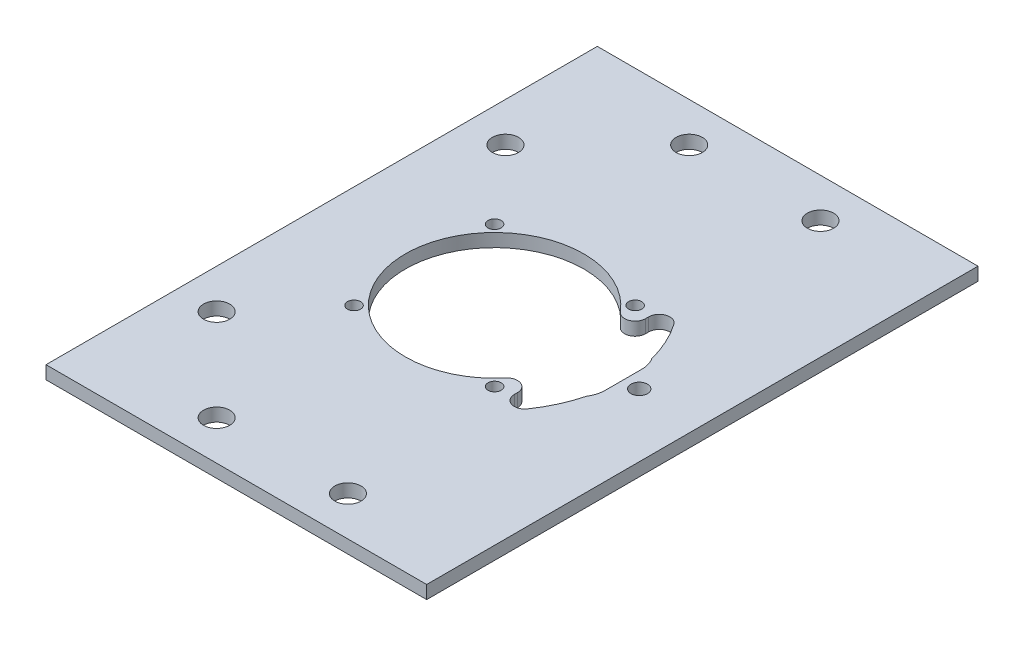
from build123d import *

# Parameters (mm, degrees)
SKETCH1_W           = 190.5
SKETCH1_H           = 133.35
BOSS_EXTRUDE1_DEPTH = 3.175
SKETCH3_R           = 21.59
CUT_EXTRUDE2_DEPTH  = 117.310785183
SKETCH4_R           = 1.5875
CUT_EXTRUDE3_DEPTH  = 3.175
SKETCH9_R           = 2
CUT_EXTRUDE5_DEPTH  = 10
SKETCH12_W          = 98.425
SKETCH12_H          = 133.35
CUT_EXTRUDE6_DEPTH  = 117.310785183
SKETCH13_R          = 3.175
CUT_EXTRUDE7_DEPTH  = 117.310785183
CUT_EXTRUDE8_DEPTH  = 117.310785183
BOSS_EXTRUDE2_DEPTH = 3.175
FILLET1_R           = 2.54
CUT_EXTRUDE9_DEPTH  = 117.310785325
FILLET2_R           = 2.54


with BuildPart() as part:
    # Sketch1 → Boss-Extrude1 (new body)
    with BuildSketch(Plane(origin=(0, 0, 0), x_dir=(1, 0, 0), z_dir=(0, 1, 0))):
        Rectangle(SKETCH1_W, SKETCH1_H)
    extrude(amount=BOSS_EXTRUDE1_DEPTH)

    # Sketch3 → Cut-Extrude2 (cut, through all)
    with BuildSketch(Plane(origin=(0, 3.175, 0), x_dir=(1, 0, 0), z_dir=(0, 1, 0))):
        with Locations(Location((-53.425, 0, 0), (0, 0, 270))):
            Circle(SKETCH3_R)
    extrude(amount=-CUT_EXTRUDE2_DEPTH, mode=Mode.SUBTRACT)

    # Sketch4 → Cut-Extrude3 (cut)
    with BuildSketch(Plane(origin=(0, 3.175, 0), x_dir=(1, 0, 0), z_dir=(0, 1, 0))):
        with Locations(Location((-70.425, 17, 0), (0, 0, 270))):
            Circle(SKETCH4_R)
        with Locations(Location((-36.425, 17, 0), (0, 0, 270))):
            Circle(SKETCH4_R)
        with Locations(Location((-70.425, -17, 0), (0, 0, 270))):
            Circle(SKETCH4_R)
        with Locations(Location((-36.425, -17, 0), (0, 0, 270))):
            Circle(SKETCH4_R)
    extrude(amount=-CUT_EXTRUDE3_DEPTH, mode=Mode.SUBTRACT)

    # Sketch9 → Cut-Extrude5 (cut)
    with BuildSketch(Plane(origin=(0, 3.175, 0), x_dir=(1, 0, 0), z_dir=(0, 1, 0))):
        with Locations(Location((-18.4365, 0, 0), (0, 0, 270))):
            Circle(SKETCH9_R)
    extrude(amount=-CUT_EXTRUDE5_DEPTH, mode=Mode.SUBTRACT)

    # Sketch12 → Cut-Extrude6 (cut, through all)
    with BuildSketch(Plane(origin=(0, 3.175, 0), x_dir=(1, 0, 0), z_dir=(0, 1, 0))):
        with Locations((46.0375, 0)):
            Rectangle(SKETCH12_W, SKETCH12_H)
    extrude(amount=-CUT_EXTRUDE6_DEPTH, mode=Mode.SUBTRACT)

    # Sketch13 → Cut-Extrude7 (cut, through all)
    with BuildSketch(Plane(origin=(0, 3.175, 0), x_dir=(1, 0, 0), z_dir=(0, 1, 0))):
        with Locations(Location((-63.5, -57.15, 0), (0, 0, 270))):
            Circle(SKETCH13_R)
        with Locations(Location((-31.75, -57.15, 0), (0, 0, 270))):
            Circle(SKETCH13_R)
        with Locations(Location((-85.725, -34.925, 0), (0, 0, 270))):
            Circle(SKETCH13_R)
        with Locations(Location((-85.725, 34.925, 0), (0, 0, 90))):
            Circle(SKETCH13_R)
        with Locations(Location((-31.75, 57.15, 0), (0, 0, 90))):
            Circle(SKETCH13_R)
        with Locations(Location((-63.5, 57.15, 0), (0, 0, 90))):
            Circle(SKETCH13_R)
    extrude(amount=-CUT_EXTRUDE7_DEPTH, mode=Mode.SUBTRACT)

    # Sketch14 → Cut-Extrude8 (cut, through all)
    with BuildSketch(Plane(origin=(0, 3.175, 0), x_dir=(1, 0, 0), z_dir=(0, 1, 0))):
        with BuildLine():
            Line((-28.5965, 10.795), (-34.727511532, 10.795))
            ThreePointArc((-34.727511532, 10.795), (-32.57066141, 5.587903184), (-31.835, 0))
            ThreePointArc((-31.835, 0), (-32.57066141, -5.587903184), (-34.727511532, -10.795))
            Line((-34.727511532, -10.795), (-28.5965, -10.795))
            ThreePointArc((-28.5965, -10.795), (-24.106371939, -8.935128061), (-22.2465, -4.445))
            Line((-22.2465, -4.445), (-22.2465, 4.445))
            ThreePointArc((-22.2465, 4.445), (-24.106371939, 8.935128061), (-28.5965, 10.795))
        make_face()
    extrude(amount=-CUT_EXTRUDE8_DEPTH, mode=Mode.SUBTRACT)

    # Sketch17 → Boss-Extrude2 (add)
    with BuildSketch(Plane(origin=(0, 3.175, 0), x_dir=(1, 0, 0), z_dir=(0, 1, 0))):
        with BuildLine():
            Line((-27.617916938, -2.569394862), (-29.842146395, -2.569394862))
            ThreePointArc((-29.842146395, -2.569394862), (-31.436748095, -3.132314839), (-32.324552038, -4.571563824))
            ThreePointArc((-32.324552038, -4.571563824), (-33.284202462, -7.776655742), (-34.727511532, -10.795))
            Line((-34.727511532, -10.795), (-28.5965, -10.795))
            ThreePointArc((-28.5965, -10.795), (-26.282004071, -10.358172465), (-24.285944537, -9.107790109))
            add(Edge.make_bspline(
                [(-24.285944537, -9.107790109), (-25.296427545, -8.702059101), (-27.426842977, -8.424005167), (-31.492325334, -5.200003891), (-29.562733021, -3.217728636), (-27.592836679, -2.82089378)],
                knots=[0.242965458, 0.242965458, 0.242965458, 0.242965458, 0.418906137, 0.719122828, 0.942603955, 0.942603955, 0.942603955, 0.942603955], degree=3))
            ThreePointArc((-27.592836679, -2.82089378), (-27.491543755, -2.683792533), (-27.617916938, -2.569394862))
        make_face()
        with BuildLine():
            Line((-34.727511532, 10.795), (-28.5965, 10.795))
            ThreePointArc((-28.5965, 10.795), (-26.282004071, 10.358172465), (-24.285944537, 9.107790109))
            add(Edge.make_bspline(
                [(-24.285944537, 9.107790109), (-25.296427545, 8.702059101), (-27.426842977, 8.424005167), (-31.492325334, 5.200003891), (-29.562733021, 3.217728636), (-27.592836679, 2.82089378)],
                knots=[0.242965458, 0.242965458, 0.242965458, 0.242965458, 0.418906137, 0.719122828, 0.942603955, 0.942603955, 0.942603955, 0.942603955], degree=3))
            ThreePointArc((-27.592836679, 2.82089378), (-27.491543755, 2.683792533), (-27.617916938, 2.569394862))
            Line((-27.617916938, 2.569394862), (-29.842146395, 2.569394862))
            ThreePointArc((-29.842146395, 2.569394862), (-31.436748095, 3.132314839), (-32.324552038, 4.571563824))
            ThreePointArc((-32.324552038, 4.571563824), (-33.284202462, 7.776655742), (-34.727511532, 10.795))
        make_face()
    extrude(amount=-BOSS_EXTRUDE2_DEPTH)

    # Fillet1
    fillet1_edges = [part.edges().sort_by_distance(p)[0] for p in [
        (-24.285944537, 1.5875, 9.107790109),
        (-24.285944537, 1.5875, -9.107790109),
    ]]
    fillet(fillet1_edges, radius=FILLET1_R)

    # Sketch20 → Cut-Extrude9 (cut, through all)
    with BuildSketch(Plane(origin=(0, 3.175, 0), x_dir=(1, 0, 0), z_dir=(0, 1, 0))):
        with BuildLine():
            Line((-32.388013842, -16.243224247), (-32.324552038, -4.571563824))
            ThreePointArc((-32.324552038, -4.571563824), (-31.835, 0), (-32.324552038, 4.571563824))
            Line((-32.324552038, 4.571563824), (-32.388013842, 16.243224247))
            ThreePointArc((-32.388013842, 16.243224247), (-30.609708534, 18.68014804), (-27.75696947, 17.698900276))
            ThreePointArc((-27.75696947, 17.698900276), (-22.2465, 0), (-27.75696947, -17.698900276))
            ThreePointArc((-27.75696947, -17.698900276), (-30.609708534, -18.68014804), (-32.388013842, -16.243224247))
        make_face()
    extrude(amount=-CUT_EXTRUDE9_DEPTH, mode=Mode.SUBTRACT)

    # Fillet2
    fillet2_edges = [part.edges().sort_by_distance(p)[0] for p in [
        (-32.324552038, 1.5875, 4.571563824),
        (-32.324552038, 1.5875, -4.571563824),
    ]]
    fillet(fillet2_edges, radius=FILLET2_R)


solid = part.part
